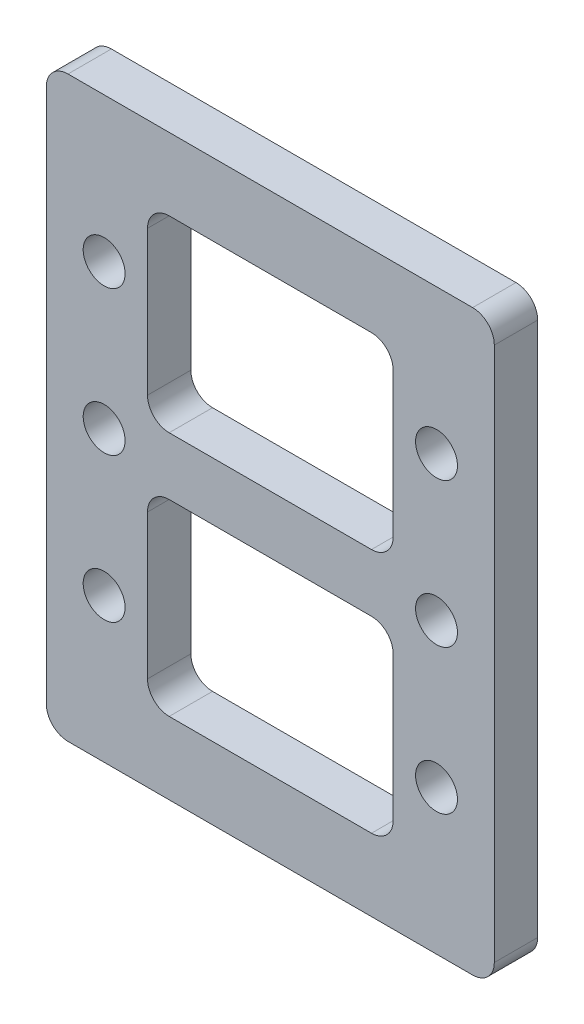
from build123d import *

# Parameters (mm, degrees)
SKETCH_1_W          = 31
SKETCH_1_H          = 40
SKETCH_1_R          = 1.45
EXTRUDE_1_DEPTH     = 3
SKETCH_2_W          = 17
SKETCH_2_H          = 13
CUT_EXTRUDE_1_DEPTH = 3
FILLET_1_R          = 1.5


with BuildPart() as part:
    # 草图1 → 凸台-拉伸1 (new body)
    with BuildSketch(Plane.XY):
        with Locations((15.5, 20)):
            Rectangle(SKETCH_1_W, SKETCH_1_H)
        with Locations((4, 30)):
            Circle(SKETCH_1_R, mode=Mode.SUBTRACT)
        with Locations((4, 20)):
            Circle(SKETCH_1_R, mode=Mode.SUBTRACT)
        with Locations((4, 10)):
            Circle(SKETCH_1_R, mode=Mode.SUBTRACT)
        with Locations((27, 30)):
            Circle(SKETCH_1_R, mode=Mode.SUBTRACT)
        with Locations((27, 20)):
            Circle(SKETCH_1_R, mode=Mode.SUBTRACT)
        with Locations((27, 10)):
            Circle(SKETCH_1_R, mode=Mode.SUBTRACT)
    extrude(amount=EXTRUDE_1_DEPTH)

    # 草图2 → 切除-拉伸1 (cut)
    with BuildSketch(Plane.XY.offset(3)):
        with Locations((15.5, 28.5)):
            Rectangle(SKETCH_2_W, SKETCH_2_H)
        with Locations((15.5, 11.5)):
            Rectangle(SKETCH_2_W, SKETCH_2_H)
    extrude(amount=-CUT_EXTRUDE_1_DEPTH, mode=Mode.SUBTRACT)

    # 圆角1
    fillet_1_edges = [part.edges().sort_by_distance(p)[0] for p in [
        (7, 22, 1.5),
        (7, 35, 1.5),
        (24, 35, 1.5),
        (24, 22, 1.5),
        (7, 5, 1.5),
        (7, 18, 1.5),
        (24, 18, 1.5),
        (24, 5, 1.5),
        (0, 40, 1.5),
        (31, 40, 1.5),
        (31, 0, 1.5),
        (0, 0, 1.5),
    ]]
    fillet(fillet_1_edges, radius=FILLET_1_R)


solid = part.part
